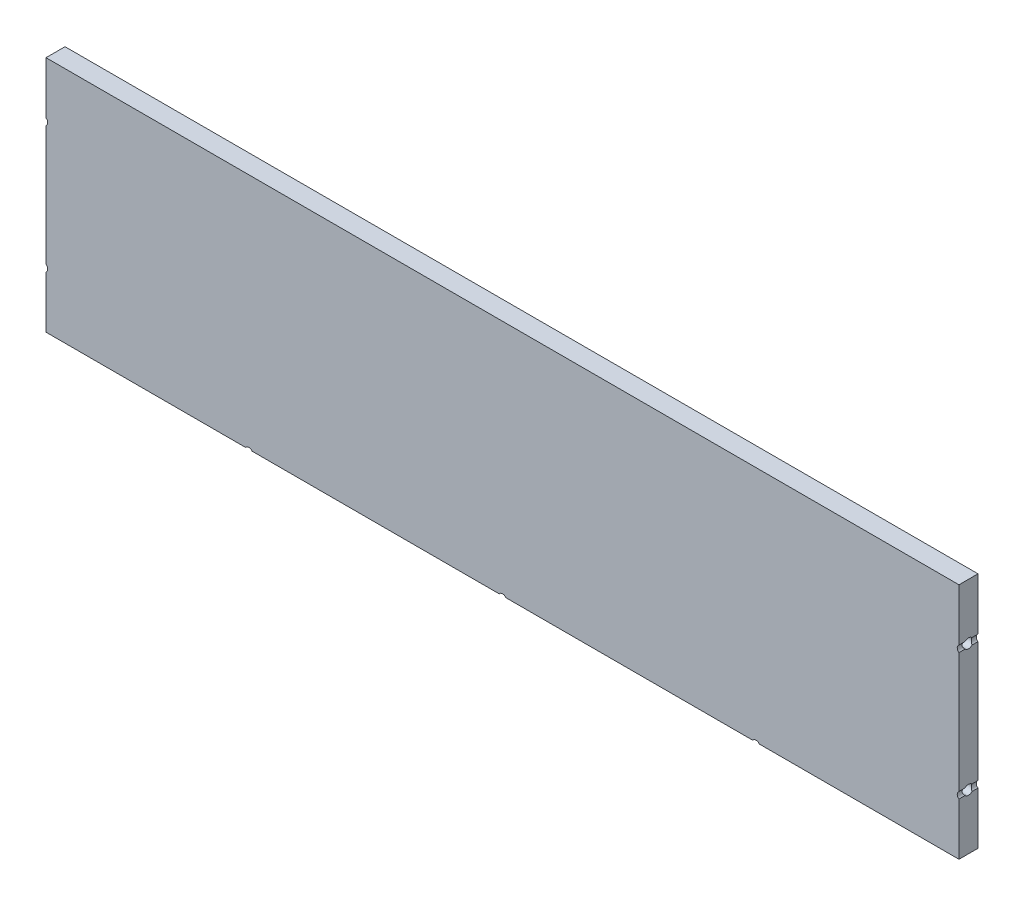
from build123d import *

# Parameters (mm, degrees)
SKETCH_1_W           = 300
SKETCH_1_H           = 145
EXTRUDE_1_DEPTH      = 81
SHELL_1_T            = -6
SKETCH_2_R           = 2.55
CUT_EXTRUDE_1_DEPTH  = 183.705363906
SKETCH_3_R           = 4.25
CUT_EXTRUDE_2_DEPTH  = 3
SKETCH_4_OUTSIDE_W   = 370.582
SKETCH_4_OUTSIDE_H   = 151.582
SKETCH_4_OUTSIDE_W_2 = 288
SKETCH_4_OUTSIDE_H_2 = 75
CUT_EXTRUDE_3_DEPTH  = 220.959087105
SKETCH_5_R           = 1.25
CUT_EXTRUDE_4_DEPTH  = 166.326948801
SKETCH_6_R           = 1.5
CUT_EXTRUDE_5_DEPTH  = 308.83315286
SKETCH_7_R           = 1.5
CUT_EXTRUDE_6_DEPTH  = 10


with BuildPart() as part:
    # ｽｹｯﾁ1 → ﾎﾞｽ - 押し出し1 (new body)
    with BuildSketch(Plane(origin=(0, 0, 0), x_dir=(1, 0, 0), z_dir=(0, 1, 0))):
        Rectangle(SKETCH_1_W, SKETCH_1_H)
    extrude(amount=EXTRUDE_1_DEPTH)

    # ｼｪﾙ1
    shell_1_openings = [part.faces().sort_by_distance(p)[0] for p in [
        (0, 81, 0),
    ]]
    offset(amount=SHELL_1_T, openings=shell_1_openings, kind=Kind.INTERSECTION)

    # ｽｹｯﾁ2 → ｶｯﾄ - 押し出し1 (cut, through all)
    with BuildSketch(Plane(origin=(0, 6, 0), x_dir=(1, 0, 0), z_dir=(0, 1, 0))):
        with Locations(Location((140, 60, 0), (0, 0, 270))):
            Circle(SKETCH_2_R)
        with Locations(Location((140, -60, 0), (0, 0, 90))):
            Circle(SKETCH_2_R)
        with Locations(Location((-22.5, -60, 0), (0, 0, 270))):
            Circle(SKETCH_2_R)
        with Locations(Location((-22.5, 60, 0), (0, 0, 90))):
            Circle(SKETCH_2_R)
    extrude(amount=-CUT_EXTRUDE_1_DEPTH, mode=Mode.SUBTRACT)

    # ｽｹｯﾁ3 → ｶｯﾄ - 押し出し2 (cut)
    with BuildSketch(Plane(origin=(0, 6, 0), x_dir=(1, 0, 0), z_dir=(0, 1, 0))):
        with Locations(Location((140, 60, 0), (0, 0, 270))):
            Circle(SKETCH_3_R)
        with Locations(Location((-22.5, 60, 0), (0, 0, 270))):
            Circle(SKETCH_3_R)
        with Locations(Location((-22.5, -60, 0), (0, 0, 270))):
            Circle(SKETCH_3_R)
        with Locations(Location((140, -60, 0), (0, 0, 270))):
            Circle(SKETCH_3_R)
    extrude(amount=-CUT_EXTRUDE_2_DEPTH, mode=Mode.SUBTRACT)

    # ｽｹｯﾁ4 outside → ｶｯﾄ - 押し出し3 (cut, through all)
    with BuildSketch(Plane(origin=(0, 0, 66.5), x_dir=(-1, 0, 0), z_dir=(0, 0, -1))):
        with Locations((0, 40.5)):
            Rectangle(SKETCH_4_OUTSIDE_W, SKETCH_4_OUTSIDE_H)
        with Locations((0, 43.5)):
            Rectangle(SKETCH_4_OUTSIDE_W_2, SKETCH_4_OUTSIDE_H_2, mode=Mode.SUBTRACT)
    extrude(amount=-CUT_EXTRUDE_3_DEPTH, mode=Mode.SUBTRACT)


with BuildPart() as cut_extrude_3_kept_piece:
    # of the separate pieces the step leaves, the one the design keeps (cut_extrude_3_pieces_kept)
    add(part.part.solids().sort_by_distance((144, 6, 72.5))[0])

    # ｽｹｯﾁ5 → ｶｯﾄ - 押し出し4 (cut, through all)
    with BuildSketch(Plane(origin=(0, 0, 66.5), x_dir=(-1, 0, 0), z_dir=(0, 0, -1))):
        with Locations((0, 5.3)):
            Circle(SKETCH_5_R)
        with Locations((-80, 5.3)):
            Circle(SKETCH_5_R)
        with Locations((80, 5.3)):
            Circle(SKETCH_5_R)
        with Locations((-144.7, 63.5)):
            Circle(SKETCH_5_R)
        with Locations((-144.7, 23.5)):
            Circle(SKETCH_5_R)
        with Locations((144.7, 23.5)):
            Circle(SKETCH_5_R)
        with Locations((144.7, 63.5)):
            Circle(SKETCH_5_R)
    extrude(amount=-CUT_EXTRUDE_4_DEPTH, mode=Mode.SUBTRACT)

    # ｽｹｯﾁ6 → ｶｯﾄ - 押し出し5 (cut, through all)
    with BuildSketch(Plane.ZY.offset(144)):
        with Locations(Location((69.5, 23.5, 0), (0, 0, 43.662612756))):
            Circle(SKETCH_6_R)
        with Locations(Location((69.5, 63.5, 0), (0, 0, 316.337387244))):
            Circle(SKETCH_6_R)
    extrude(amount=-CUT_EXTRUDE_5_DEPTH, mode=Mode.SUBTRACT)

    # ｽｹｯﾁ7 → ｶｯﾄ - 押し出し6 (cut)
    with BuildSketch(Plane.XZ.offset(-6)):
        with Locations(Location((80, 69.5, 0), (0, 0, 270))):
            Circle(SKETCH_7_R)
        with Locations(Location((0, 69.5, 0), (0, 0, 270))):
            Circle(SKETCH_7_R)
        with Locations(Location((-80, 69.5, 0), (0, 0, 270))):
            Circle(SKETCH_7_R)
    extrude(amount=-CUT_EXTRUDE_6_DEPTH, mode=Mode.SUBTRACT)


solid = cut_extrude_3_kept_piece.part
